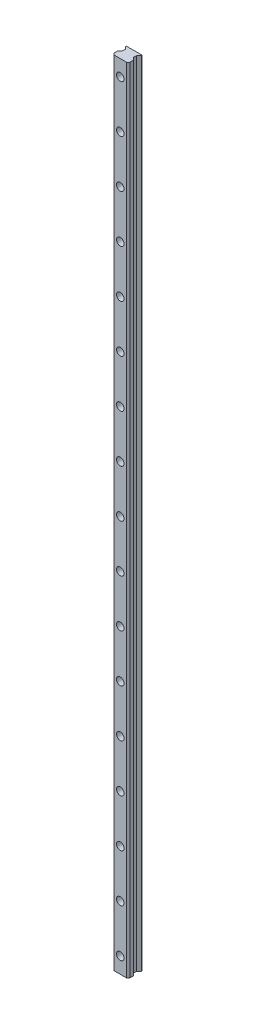
from build123d import *

# Parameters (mm, degrees)
SKETCH_1_W          = 20
SKETCH_1_H          = 17.5
EXTRUDE_1_DEPTH     = 1000
CUT_EXTRUDE_1_DEPTH = 1001.088277354
SKETCH_3_R          = 3
CUT_EXTRUDE_2_DEPTH = 1001.203104374
SKETCH_4_R          = 4.75
CUT_EXTRUDE_3_DEPTH = 10


with BuildPart() as part:
    # 草图1 → 凸台-拉伸1 (new body)
    with BuildSketch(Plane(origin=(0, 0, 0), x_dir=(1, 0, 0), z_dir=(0, 1, 0))):
        Rectangle(SKETCH_1_W, SKETCH_1_H)
    extrude(amount=EXTRUDE_1_DEPTH)

    # 草图2 → 切除-拉伸1 (cut, through all)
    with BuildSketch(Plane.XZ):
        Polygon((-8, 8.75), (-10, 6.75), (-10, 8.75), align=None)
        Polygon((10, 6.75), (8, 8.75), (10, 8.75), align=None)
        Polygon((10, 2.25), (7, -0.75), (7, -4.75), (10, -7.75), align=None)
        Polygon((-7, -4.75), (-10, -7.75), (-10, 2.25), (-7, -0.75), align=None)
    extrude(amount=-CUT_EXTRUDE_1_DEPTH, mode=Mode.SUBTRACT)

    # 草图3 → 切除-拉伸2 (cut, through all)
    with BuildSketch(Plane.XY.offset(8.75)):
        with Locations((0, 980)):
            Circle(SKETCH_3_R)
        with Locations((0, 920)):
            Circle(SKETCH_3_R)
        with Locations((0, 860)):
            Circle(SKETCH_3_R)
        with Locations((0, 800)):
            Circle(SKETCH_3_R)
        with Locations((0, 740)):
            Circle(SKETCH_3_R)
        with Locations((0, 680)):
            Circle(SKETCH_3_R)
        with Locations((0, 620)):
            Circle(SKETCH_3_R)
        with Locations((0, 560)):
            Circle(SKETCH_3_R)
        with Locations((0, 500)):
            Circle(SKETCH_3_R)
        with Locations((0, 440)):
            Circle(SKETCH_3_R)
        with Locations((0, 380)):
            Circle(SKETCH_3_R)
        with Locations((0, 320)):
            Circle(SKETCH_3_R)
        with Locations((0, 260)):
            Circle(SKETCH_3_R)
        with Locations((0, 200)):
            Circle(SKETCH_3_R)
        with Locations((0, 140)):
            Circle(SKETCH_3_R)
        with Locations((0, 80)):
            Circle(SKETCH_3_R)
        with Locations((0, 20)):
            Circle(SKETCH_3_R)
    extrude(amount=-CUT_EXTRUDE_2_DEPTH, mode=Mode.SUBTRACT)

    # 草图4 → 切除-拉伸3 (cut)
    with BuildSketch(Plane.XY.offset(8.75)):
        with Locations((0, 980)):
            Circle(SKETCH_4_R)
        with Locations((0, 920)):
            Circle(SKETCH_4_R)
        with Locations((0, 860)):
            Circle(SKETCH_4_R)
        with Locations((0, 800)):
            Circle(SKETCH_4_R)
        with Locations((0, 740)):
            Circle(SKETCH_4_R)
        with Locations((0, 680)):
            Circle(SKETCH_4_R)
        with Locations((0, 620)):
            Circle(SKETCH_4_R)
        with Locations((0, 560)):
            Circle(SKETCH_4_R)
        with Locations((0, 500)):
            Circle(SKETCH_4_R)
        with Locations((0, 440)):
            Circle(SKETCH_4_R)
        with Locations((0, 380)):
            Circle(SKETCH_4_R)
        with Locations((0, 320)):
            Circle(SKETCH_4_R)
        with Locations((0, 260)):
            Circle(SKETCH_4_R)
        with Locations((0, 200)):
            Circle(SKETCH_4_R)
        with Locations((0, 140)):
            Circle(SKETCH_4_R)
        with Locations((0, 80)):
            Circle(SKETCH_4_R)
        with Locations((0, 20)):
            Circle(SKETCH_4_R)
    extrude(amount=-CUT_EXTRUDE_3_DEPTH, mode=Mode.SUBTRACT)


solid = part.part
